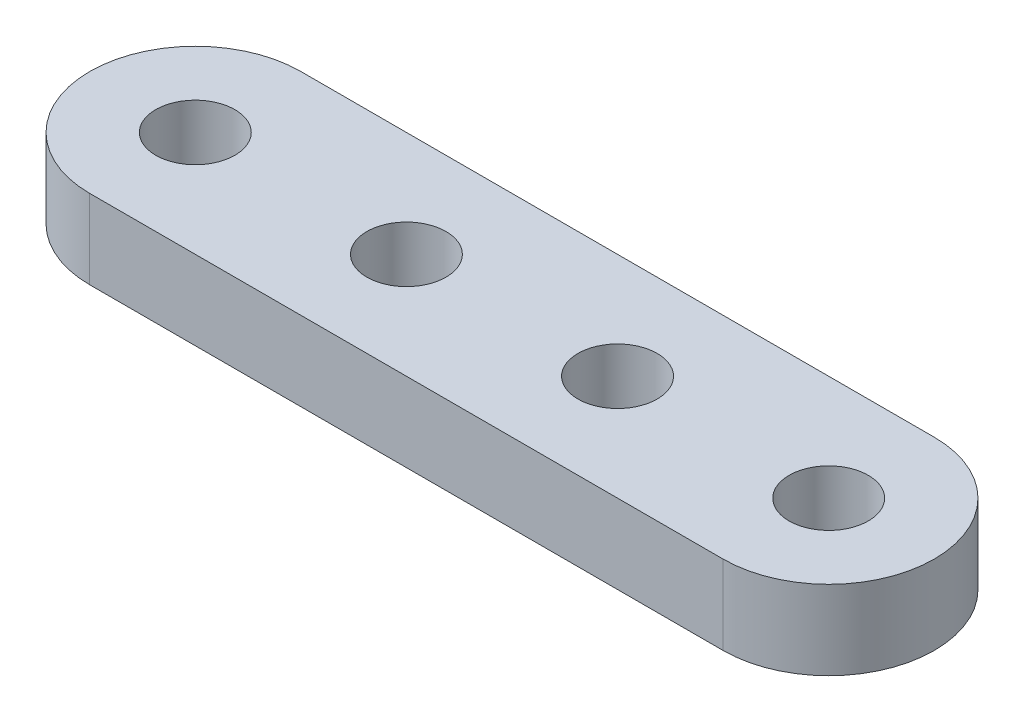
from build123d import *

# Parameters (mm, degrees)
SKETCH2_R           = 1.5
BOSS_EXTRUDE2_DEPTH = 3


with BuildPart() as part:
    # Sketch2 → Boss-Extrude2 (new body)
    with BuildSketch(Plane(origin=(0, 0, 0), x_dir=(1, 0, 0), z_dir=(0, 1, 0))):
        with BuildLine():
            Line((0, 4), (24, 4))
            ThreePointArc((24, 4), (28, 0), (24, -4))
            Line((24, -4), (0, -4))
            ThreePointArc((0, -4), (-4, 0), (0, 4))
        make_face()
        with Locations(Location((0, 0, 0), (0, 0, 270))):
            Circle(SKETCH2_R, mode=Mode.SUBTRACT)
        with Locations(Location((8, 0, 0), (0, 0, 270))):
            Circle(SKETCH2_R, mode=Mode.SUBTRACT)
        with Locations(Location((16, 0, 0), (0, 0, 270))):
            Circle(SKETCH2_R, mode=Mode.SUBTRACT)
        with Locations(Location((24, 0, 0), (0, 0, 270))):
            Circle(SKETCH2_R, mode=Mode.SUBTRACT)
    extrude(amount=BOSS_EXTRUDE2_DEPTH)


solid = part.part
